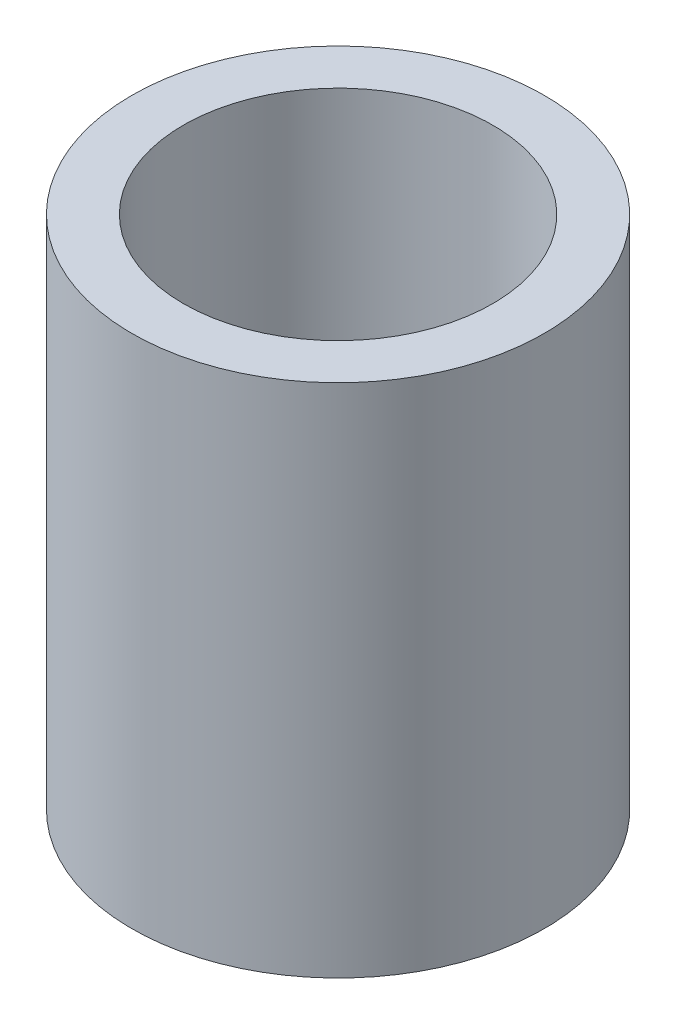
from build123d import *

# Parameters (mm, degrees)
SKETCH_3_W          = 4
SKETCH_3_H          = 10
CUT_EXTRUDE_1_DEPTH = 25


with BuildPart() as part:
    # 草圖3 → 旋轉1 (revolve)
    with BuildSketch(Plane.XY):
        with Locations((-2, -21.260913462)):
            Rectangle(SKETCH_3_W, SKETCH_3_H)
    revolve(axis=Axis((0, -16.260913462, 0), (0, -1, 0)))

    # 草圖4 → 除料-伸長1 (cut)
    with BuildSketch(Plane(origin=(0, 0, 0), x_dir=(1, 0, 0), z_dir=(0, 1, 0))):
        with BuildLine():
            Line((3.000522643, 0), (0, 0))
            Line((0, 0), (-2.999477357, 0))
            ThreePointArc((-2.999477357, 0), (0.000522643, -3), (3.000522643, 0))
        make_face()
        with BuildLine():
            Line((-2.999477357, 0), (0, 0))
            Line((0, 0), (3.000522643, 0))
            ThreePointArc((3.000522643, 0), (0.000522643, 3), (-2.999477357, 0))
        make_face()
    extrude(amount=-CUT_EXTRUDE_1_DEPTH, mode=Mode.SUBTRACT)


solid = part.part
